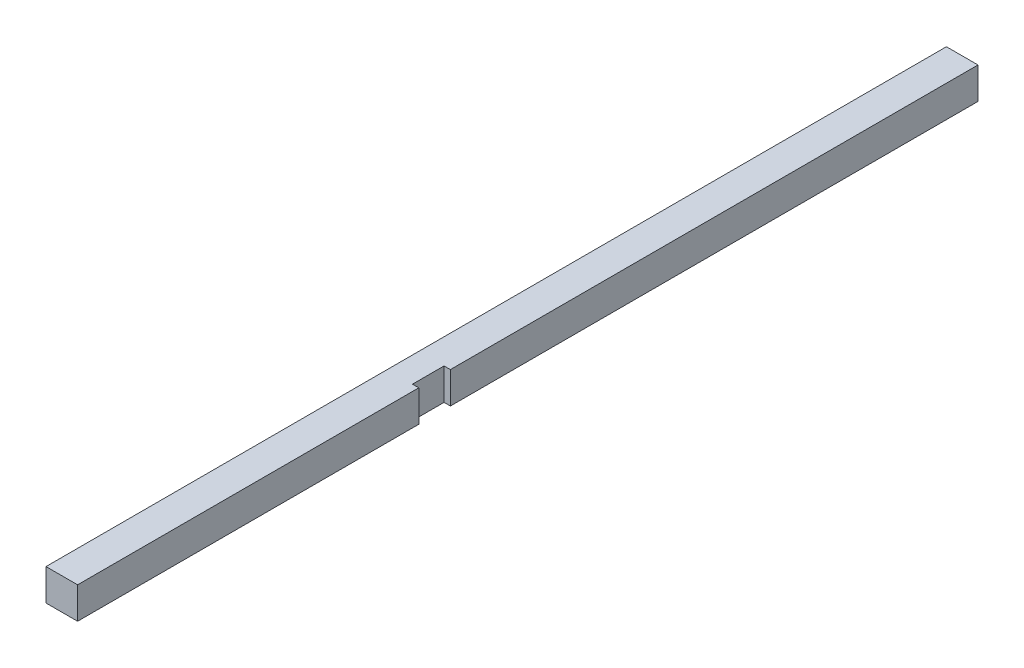
from build123d import *

# Parameters (mm, degrees)
ESQUISSE1_W             = 10
ESQUISSE1_H             = 10
BOSS_EXTRU_1_DEPTH      = 285
ESQUISSE2_W             = 2
ESQUISSE2_H             = 10
ENL_V_MAT_EXTRU_1_DEPTH = 286.350661468


with BuildPart() as part:
    # Esquisse1 → Boss.-Extru.1 (new body)
    with BuildSketch(Plane.XY):
        with Locations((5, 5)):
            Rectangle(ESQUISSE1_W, ESQUISSE1_H)
    extrude(amount=BOSS_EXTRU_1_DEPTH)

    # Esquisse2 → Enlèv. mat.-Extru.1 (cut, through all)
    with BuildSketch(Plane(origin=(0, 10, 0), x_dir=(1, 0, 0), z_dir=(0, 1, 0))):
        with Locations((9, -172)):
            Rectangle(ESQUISSE2_W, ESQUISSE2_H)
    extrude(amount=-ENL_V_MAT_EXTRU_1_DEPTH, mode=Mode.SUBTRACT)


solid = part.part
